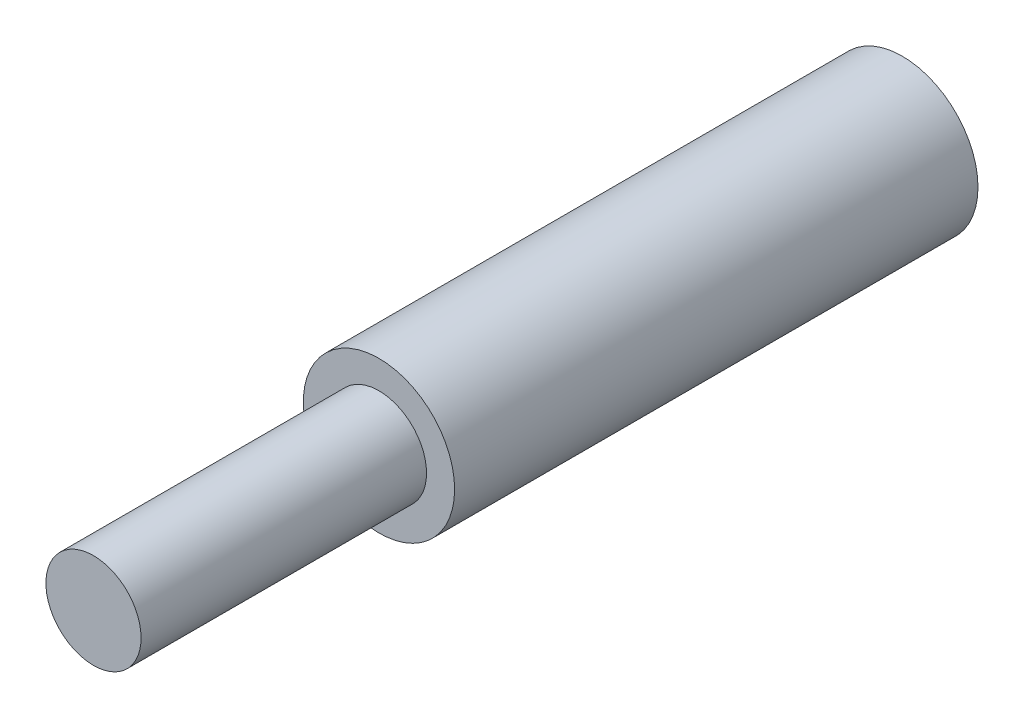
from build123d import *

# Parameters (mm, degrees)
SKETCH1_R           = 1.59
BOSS_EXTRUDE1_DEPTH = 11
SKETCH2_R           = 1
BOSS_EXTRUDE2_DEPTH = 6


with BuildPart() as part:
    # Sketch1 → Boss-Extrude1 (new body)
    with BuildSketch(Plane.XY):
        Circle(SKETCH1_R)
    extrude(amount=BOSS_EXTRUDE1_DEPTH)

    # Sketch2 → Boss-Extrude2 (add)
    with BuildSketch(Plane.XY.offset(11)):
        Circle(SKETCH2_R)
    extrude(amount=BOSS_EXTRUDE2_DEPTH)


solid = part.part
